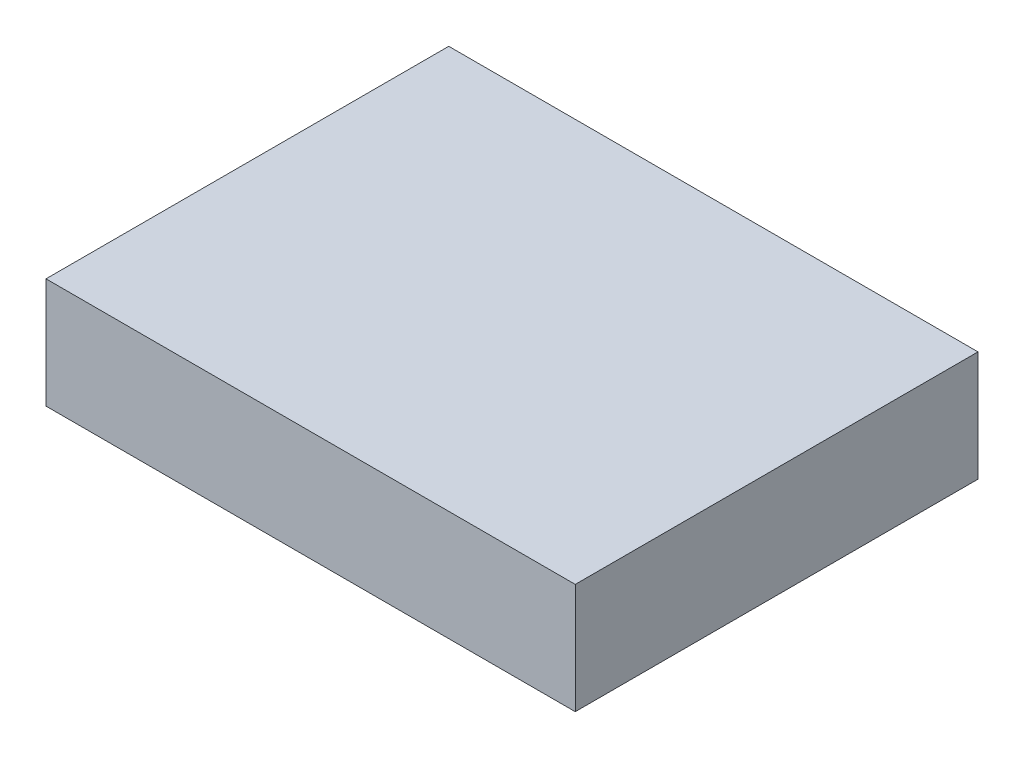
from build123d import *

# Parameters (mm, degrees)
SKETCH1_W           = 45.6
SKETCH1_H           = 34.7
BOSS_EXTRUDE1_DEPTH = 9.5


with BuildPart() as part:
    # Sketch1 → Boss-Extrude1 (new body)
    with BuildSketch(Plane(origin=(0, 0, 0), x_dir=(1, 0, 0), z_dir=(0, 1, 0))):
        Rectangle(SKETCH1_W, SKETCH1_H)
    extrude(amount=BOSS_EXTRUDE1_DEPTH)


solid = part.part
